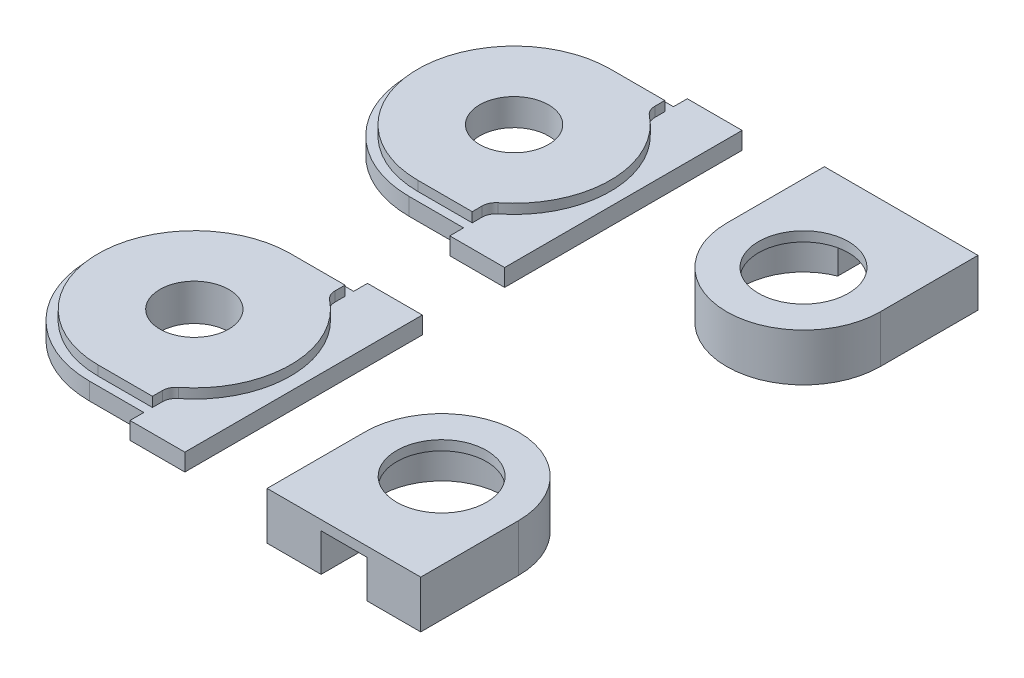
from build123d import *

# Parameters (mm, degrees)
BOSS_EXTRUDE1_DEPTH   = 4
BOSS_EXTRUDE2_DEPTH   = 2.25
SKETCH3_R             = 7.975
CUT_EXTRUDE1_DEPTH    = 9.25
CUT_EXTRUDE3_DEPTH    = 3.1
FILLET1_R             = 3.175
BOSS_EXTRUDE3_DEPTH   = 4
FILLET3_R             = 3.175
SKETCH7_W             = 17.618821415
SKETCH7_H             = 1.769638423
BOSS_EXTRUDE4_DEPTH   = 10
SKETCH8_W             = 35.23764283
SKETCH8_H             = 1.769638423
CUT_EXTRUDE4_DEPTH    = 10
SKETCH9_R             = 11.975
SKETCH9_R_2           = 7.975
BOSS_EXTRUDE5_DEPTH   = 2.25
BOSS_EXTRUDE6_DEPTH   = 10.999978
BOSS_EXTRUDE6_2_DEPTH = 10.999978
SKETCH11_R            = 10.4013
BOSS_EXTRUDE9_DEPTH   = 2.250000072


with BuildPart() as part:
    # Sketch1 → Boss-Extrude1 (new body)
    with BuildSketch(Plane(origin=(0, 0, 0), x_dir=(1, 0, 0), z_dir=(0, 1, 0))):
        with BuildLine():
            Line((-13.29118379, 20.889836125), (-0.68999579, 20.889836125))
            Line((-0.68999579, 20.889836125), (-0.68999579, 24.09210312))
            Line((-0.68999579, 24.09210312), (-0.68999579, 26.09210312))
            Line((-0.68999579, 26.09210312), (12.01000421, 26.09210312))
            Line((12.01000421, 26.09210312), (12.01000421, 24.09210312))
            Line((12.01000421, 24.09210312), (12.01000421, -26.90789688))
            Line((12.01000421, -26.90789688), (12.01000421, -28.90789688))
            Line((12.01000421, -28.90789688), (-0.68999579, -28.90789688))
            Line((-0.68999579, -28.90789688), (-0.68999579, -26.90789688))
            Line((-0.68999579, -26.90789688), (-0.68999579, -23.705629885))
            Line((-0.68999579, -23.705629885), (-13.29118379, -23.705629885))
            ThreePointArc((-13.29118379, -23.705629885), (-35.588916795, -1.40789688), (-13.29118379, 20.889836125))
        make_face()
    extrude(amount=BOSS_EXTRUDE1_DEPTH)

    # Sketch2 → Boss-Extrude2 (add)
    with BuildSketch(Plane(origin=(0, 4, 0), x_dir=(1, 0, 0), z_dir=(0, 1, 0))):
        with BuildLine():
            Line((-0.68999579, 20.889836125), (-0.68999579, 16.987726462))
            ThreePointArc((-0.68999579, 16.987726462), (9.006549215, -1.40789688), (-0.68999579, -19.803520222))
            Line((-0.68999579, -19.803520222), (-0.68999579, -23.705629885))
            Line((-0.68999579, -23.705629885), (-13.29118379, -23.705629885))
            ThreePointArc((-13.29118379, -23.705629885), (-35.588916795, -1.40789688), (-13.29118379, 20.889836125))
            Line((-13.29118379, 20.889836125), (-0.68999579, 20.889836125))
        make_face()
    extrude(amount=BOSS_EXTRUDE2_DEPTH)

    # Sketch3 → Cut-Extrude1 (cut)
    with BuildSketch(Plane.XZ):
        with Locations((-13.29118379, 1.40789688)):
            Circle(SKETCH3_R)
    extrude(amount=-CUT_EXTRUDE1_DEPTH, mode=Mode.SUBTRACT)

    # Sketch5 → Cut-Extrude3 (cut)
    with BuildSketch(Plane.XZ):
        with BuildLine():
            ThreePointArc((-20.933187177, -7.811669771), (-25.26618379, 1.40789688), (-20.933187177, 10.62746353))
            Line((-20.933187177, 10.62746353), (-24.206508111, 16.313644763))
            ThreePointArc((-24.206508111, 16.313644763), (-31.76618379, 1.40789688), (-24.206508111, -13.497851004))
            Line((-24.206508111, -13.497851004), (-20.933187177, -7.811669771))
        make_face()
        with BuildLine():
            Line((-20.742277958, 18.313718974), (-17.454561027, 12.635849274))
            ThreePointArc((-17.454561027, 12.635849274), (-7.30368379, 11.77855109), (-1.485803165, 3.416282624))
            Line((-1.485803165, 3.416282624), (5.0752347, 3.407971091))
            ThreePointArc((5.0752347, 3.407971091), (-4.05368379, 17.407716215), (-20.742277958, 18.313718974))
        make_face()
        with BuildLine():
            ThreePointArc((-1.485803165, -0.600488865), (-7.30368379, -8.962757331), (-17.454561027, -9.820055515))
            Line((-17.454561027, -9.820055515), (-20.742277958, -15.497925215))
            ThreePointArc((-20.742277958, -15.497925215), (-4.05368379, -14.591922455), (5.0752347, -0.592177331))
            Line((5.0752347, -0.592177331), (-1.485803165, -0.600488865))
        make_face()
    extrude(amount=-CUT_EXTRUDE3_DEPTH, mode=Mode.SUBTRACT)

    # Fillet1
    fillet1_edges = [part.edges().sort_by_distance(p)[0] for p in [
        (5.0752347, 1.55, 3.407971091),
        (-1.485803165, 1.55, 3.416282624),
        (5.0752347, 1.55, -0.592177331),
        (-24.206508111, 1.55, 16.313644763),
        (-20.742277958, 1.55, 18.313718974),
        (-1.485803165, 1.55, -0.600488865),
        (-20.742277958, 1.55, -15.497925215),
        (-20.933187177, 1.55, 10.62746353),
        (-20.933187177, 1.55, -7.811669771),
        (-24.206508111, 1.55, -13.497851004),
        (-17.454561027, 1.55, -9.820055515),
        (-17.454561027, 1.55, 12.635849274),
    ]]
    fillet(fillet1_edges, radius=FILLET1_R)

    # Sketch6 → Boss-Extrude3 (add)
    with BuildSketch(Plane.XZ):
        with BuildLine():
            Line((-0.68999579, -22.889836125), (-13.29118379, -22.889836125))
            ThreePointArc((-13.29118379, -22.889836125), (-37.588916795, 1.40789688), (-13.29118379, 25.705629885))
            Line((-13.29118379, 25.705629885), (-0.68999579, 25.705629885))
            Line((-0.68999579, 25.705629885), (-0.68999579, 23.705629885))
            Line((-0.68999579, 23.705629885), (-13.29118379, 23.705629885))
            ThreePointArc((-13.29118379, 23.705629885), (-35.588916795, 1.40789688), (-13.29118379, -20.889836125))
            Line((-13.29118379, -20.889836125), (-0.68999579, -20.889836125))
            Line((-0.68999579, -20.889836125), (-0.68999579, -22.889836125))
        make_face()
    extrude(amount=-BOSS_EXTRUDE3_DEPTH)

    # Fillet3
    fillet3_edges = [part.edges().sort_by_distance(p)[0] for p in [
        (-0.68999579, 5.125, -16.987726462),
        (-0.68999579, 5.125, 19.803520222),
    ]]
    fillet(fillet3_edges, radius=FILLET3_R)

    # Sketch7 → Boss-Extrude4 (add)
    with BuildSketch(Plane(origin=(12.01000421, 0, 0), x_dir=(0, 0, -1), z_dir=(1, 0, 0))):
        with Locations((-29.623486173, -0.884819212)):
            Rectangle(SKETCH7_W, SKETCH7_H)
    extrude(amount=-BOSS_EXTRUDE4_DEPTH)

    # Mirror2: part across plane


with BuildPart() as part_1:
    add(part.part)
    add(part.part.mirror(Plane.XY.offset(38.43289688)))

    # Sketch8 → Cut-Extrude4 (cut)
    with BuildSketch(Plane(origin=(12.01000421, 0, 0), x_dir=(0, 0, -1), z_dir=(1, 0, 0))):
        with Locations((-38.43289688, -0.884819212)):
            Rectangle(SKETCH8_W, SKETCH8_H)
    extrude(amount=-CUT_EXTRUDE4_DEPTH, mode=Mode.SUBTRACT)


with BuildPart() as cut_extrude4_piece_1:
    # of the separate pieces the step leaves, piece 1, a body of its own (cut_extrude4_pieces)
    add(part_1.part.solids().sort_by_distance((12.01000421, 0, 102.95789688))[0])

    # Sketch9 → Boss-Extrude5 (add)
    with BuildSketch(Plane.XZ):
        with Locations((-13.29118379, 75.45789688)):
            Circle(SKETCH9_R)
        with Locations((-13.29118379, 75.45789688)):
            Circle(SKETCH9_R_2, mode=Mode.SUBTRACT)
    extrude(amount=BOSS_EXTRUDE5_DEPTH)


with BuildPart() as cut_extrude4_piece_2:
    # of the separate pieces the step leaves, piece 2, a body of its own (cut_extrude4_pieces)
    add(part_1.part.solids().sort_by_distance((-0.68999579, 4, -18.591403581))[0])


with BuildPart() as body_3:
    # Sketch10 → Boss-Extrude6 (new body)
    with BuildSketch(Plane(origin=(0, 6.25, 0), x_dir=(1, 0, 0), z_dir=(0, 1, 0))):
        with BuildLine():
            Line((31.06000421, -102.95789688), (43.55947821, -102.95789688))
            Line((43.55947821, -102.95789688), (43.55947821, -93.562334646))
            ThreePointArc((43.55947821, -93.562334646), (48.84750421, -66.079826153), (54.13553021, -93.562334646))
            Line((54.13553021, -93.562334646), (54.13553021, -102.95789688))
            Line((54.13553021, -102.95789688), (66.63500421, -102.95789688))
            Line((66.63500421, -102.95789688), (66.63500421, -80.329826153))
            ThreePointArc((66.63500421, -80.329826153), (48.84750421, -62.542326153), (31.06000421, -80.329826153))
            Line((31.06000421, -80.329826153), (31.06000421, -102.95789688))
        make_face()
    extrude(amount=-BOSS_EXTRUDE6_DEPTH)



with BuildPart() as body_4:
    # Sketch10 → Boss-Extrude6 2 (new body)
    with BuildSketch(Plane(origin=(0, 6.25, 0), x_dir=(1, 0, 0), z_dir=(0, 1, 0))):
        with BuildLine():
            Line((54.13553021, 26.09210312), (66.63500421, 26.09210312))
            Line((66.63500421, 26.09210312), (66.63500421, 3.464032394))
            ThreePointArc((66.63500421, 3.464032394), (48.84750421, -14.323467606), (31.06000421, 3.464032394))
            Line((31.06000421, 3.464032394), (31.06000421, 26.09210312))
            Line((31.06000421, 26.09210312), (43.55947821, 26.09210312))
            Line((43.55947821, 26.09210312), (43.55947821, 16.696540887))
            ThreePointArc((43.55947821, 16.696540887), (48.84750421, -10.785967606), (54.13553021, 16.696540887))
            Line((54.13553021, 16.696540887), (54.13553021, 26.09210312))
        make_face()
    extrude(amount=-BOSS_EXTRUDE6_2_DEPTH)


with BuildPart() as body_3_1:
    add(body_3.part)

    add(body_4.part)  # Boss-Extrude9 merges body 4
    # Sketch11 → Boss-Extrude9 (add)
    # profile 1 of 2: a face of its own
    with BuildSketch(Plane(origin=(0, 6.25, 0), x_dir=(1, 0, 0), z_dir=(0, 1, 0))):
        with BuildLine():
            Line((43.55947821, -102.95789688), (54.13553021, -102.95789688))
            Line((54.13553021, -102.95789688), (54.13553021, -93.562334646))
            ThreePointArc((54.13553021, -93.562334646), (48.84750421, -66.079826153), (43.55947821, -93.562334646))
            Line((43.55947821, -93.562334646), (43.55947821, -102.95789688))
        make_face()
        with Locations((48.84750421, -80.329826153)):
            Circle(SKETCH11_R, mode=Mode.SUBTRACT)
    # profile 2 of 2: a face of its own
    with BuildSketch(Plane(origin=(0, 6.25, 0), x_dir=(1, 0, 0), z_dir=(0, 1, 0))):
        with BuildLine():
            Line((54.13553021, 16.696540887), (54.13553021, 26.09210312))
            Line((54.13553021, 26.09210312), (43.55947821, 26.09210312))
            Line((43.55947821, 26.09210312), (43.55947821, 16.696540887))
            ThreePointArc((43.55947821, 16.696540887), (48.84750421, -10.785967606), (54.13553021, 16.696540887))
        make_face()
        with Locations((48.84750421, 3.464032394)):
            Circle(SKETCH11_R, mode=Mode.SUBTRACT)
    extrude(amount=-BOSS_EXTRUDE9_DEPTH)


solid = Compound([cut_extrude4_piece_1.part, cut_extrude4_piece_2.part, body_3_1.part])
